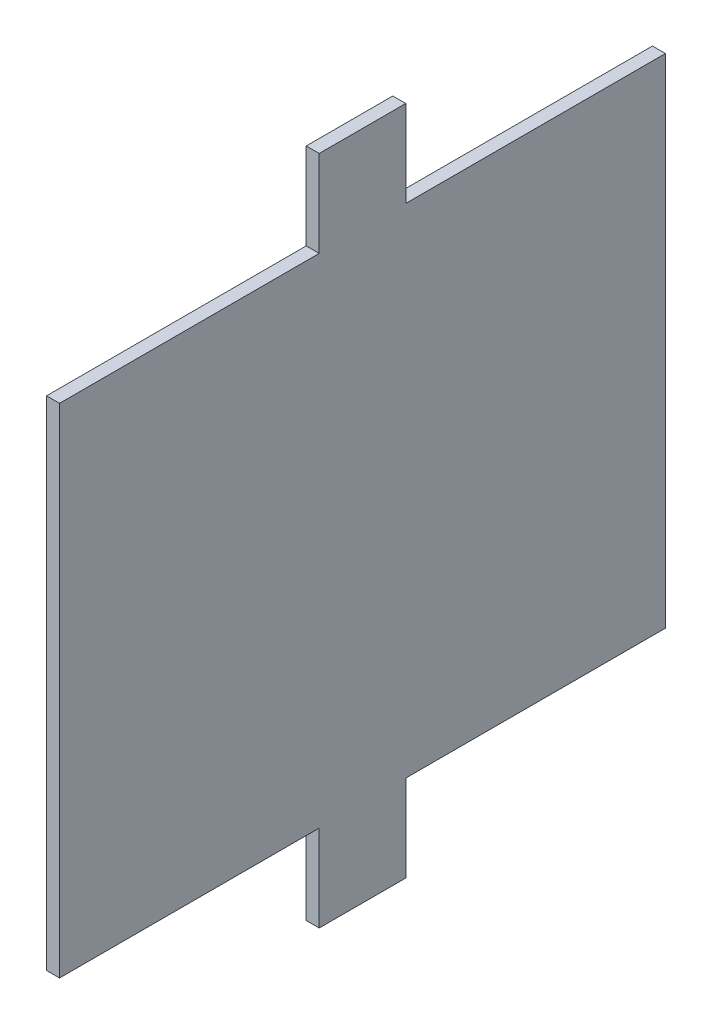
from build123d import *

# Parameters (mm, degrees)
BOSS_EXTRUDE1_DEPTH = 3.81


with BuildPart() as part:
    # Sketch1 → Boss-Extrude1 (new, symmetric)
    with BuildSketch(Plane(origin=(0, 0, 0), x_dir=(0, 0, -1), z_dir=(1, 0, 0))):
        Polygon((48.711396512, 200.82284349), (201.111396512, 200.82284349), (201.111396512, -91.27715651), (48.711396512, -91.27715651), (48.711396512, -142.07715651), (-2.088603488, -142.07715651), (-2.088603488, -91.27715651), (-154.488603488, -91.27715651), (-154.488603488, 200.82284349), (-2.088603488, 200.82284349), (-2.088603488, 251.62284349), (48.711396512, 251.62284349), align=None)
    extrude(amount=BOSS_EXTRUDE1_DEPTH, both=True)


solid = part.part
